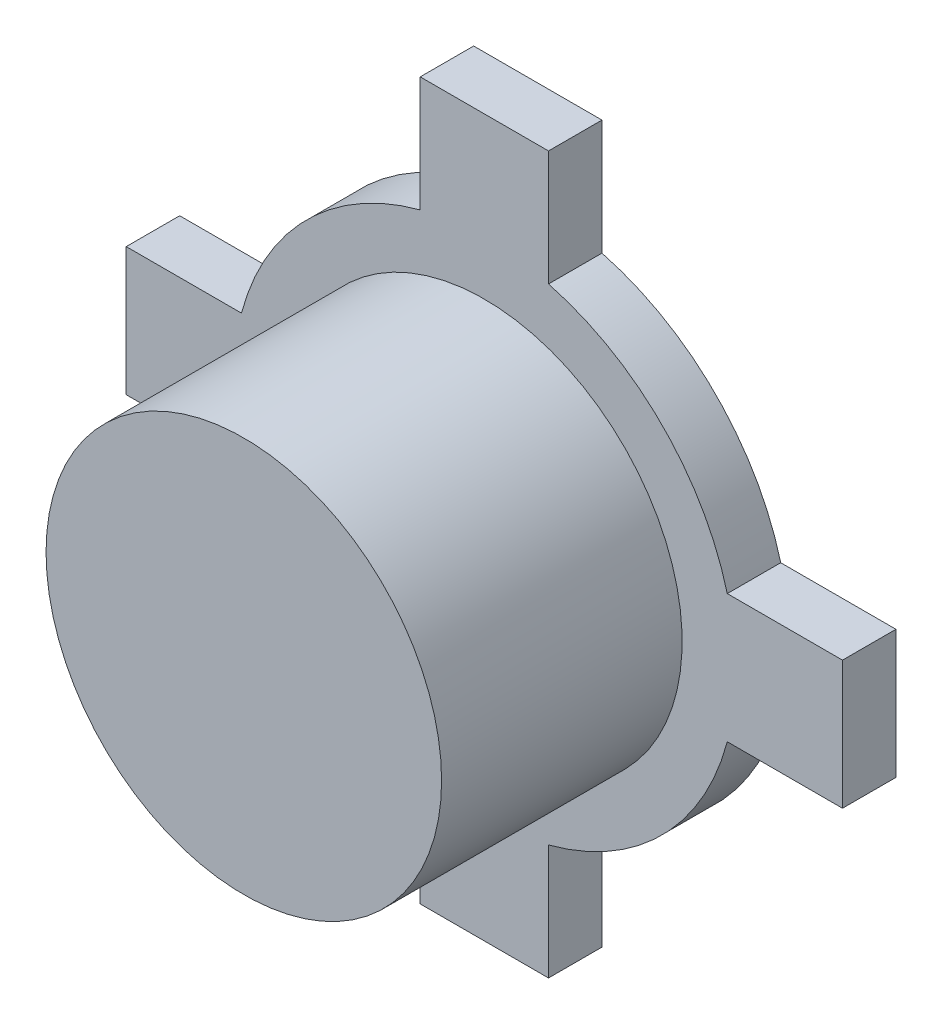
from build123d import *

# Parameters (mm, degrees)
SKETCH1_R           = 3.7
BOSS_EXTRUDE1_DEPTH = 4.5
BOSS_EXTRUDE2_DEPTH = 1


with BuildPart() as part:
    # Sketch1 → Boss-Extrude1 (new body)
    with BuildSketch(Plane.XY):
        Circle(SKETCH1_R)
    extrude(amount=BOSS_EXTRUDE1_DEPTH)

    # Sketch2 → Boss-Extrude2 (add)
    with BuildSketch(Plane(origin=(0, 0, 0), x_dir=(-1, 0, 0), z_dir=(0, 0, -1))):
        with BuildLine():
            Line((-1.2, 6.7), (-1.2, 4.544227107))
            ThreePointArc((-1.2, 4.544227107), (-3.323401872, 3.323401872), (-4.544227107, 1.2))
            Line((-4.544227107, 1.2), (-6.7, 1.2))
            Line((-6.7, 1.2), (-6.7, -1.2))
            Line((-6.7, -1.2), (-4.544227107, -1.2))
            ThreePointArc((-4.544227107, -1.2), (-3.323401872, -3.323401872), (-1.2, -4.544227107))
            Line((-1.2, -4.544227107), (-1.2, -6.7))
            Line((-1.2, -6.7), (1.2, -6.7))
            Line((1.2, -6.7), (1.2, -4.544227107))
            ThreePointArc((1.2, -4.544227107), (3.323401872, -3.323401872), (4.544227107, -1.2))
            Line((4.544227107, -1.2), (6.7, -1.2))
            Line((6.7, -1.2), (6.7, 1.2))
            Line((6.7, 1.2), (4.544227107, 1.2))
            ThreePointArc((4.544227107, 1.2), (3.323401872, 3.323401872), (1.2, 4.544227107))
            Line((1.2, 4.544227107), (1.2, 6.7))
            Line((1.2, 6.7), (-1.2, 6.7))
        make_face()
    extrude(amount=BOSS_EXTRUDE2_DEPTH)


solid = part.part
